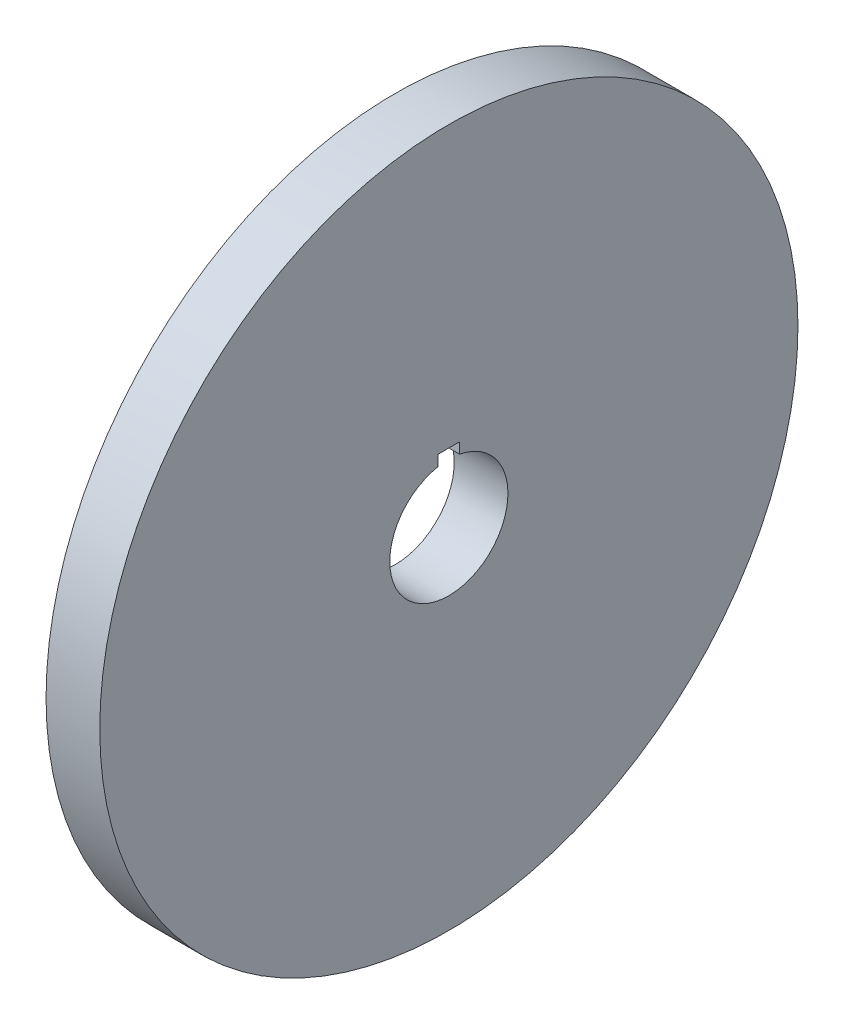
from build123d import *

# Parameters (mm, degrees)
SKETCH1_R           = 65
BOSS_EXTRUDE1_DEPTH = 5
SKETCH3_R           = 11
CUT_EXTRUDE2_DEPTH  = 93.466210045
CUT_EXTRUDE5_DEPTH  = 93.466210045


with BuildPart() as part:
    # Sketch1 → Boss-Extrude1 (new, symmetric)
    with BuildSketch(Plane(origin=(0, 0, 0), x_dir=(0, 0, -1), z_dir=(1, 0, 0))):
        Circle(SKETCH1_R)
    extrude(amount=BOSS_EXTRUDE1_DEPTH, both=True)

    # Sketch3 → Cut-Extrude2 (cut, through all)
    with BuildSketch(Plane(origin=(5, 0, 0), x_dir=(0, 0, -1), z_dir=(1, 0, 0))):
        Circle(SKETCH3_R)
    extrude(amount=-CUT_EXTRUDE2_DEPTH, mode=Mode.SUBTRACT)

    # Sketch5 → Cut-Extrude5 (cut, through all)
    with BuildSketch(Plane(origin=(5, 0, 0), x_dir=(0, 0, -1), z_dir=(1, 0, 0))):
        with BuildLine():
            Line((-2, 10.816653826), (-2, 12.816653826))
            Line((-2, 12.816653826), (2, 12.816653826))
            Line((2, 12.816653826), (2, 10.816653826))
            ThreePointArc((2, 10.816653826), (0, 11), (-2, 10.816653826))
        make_face()
    extrude(amount=-CUT_EXTRUDE5_DEPTH, mode=Mode.SUBTRACT)


solid = part.part
